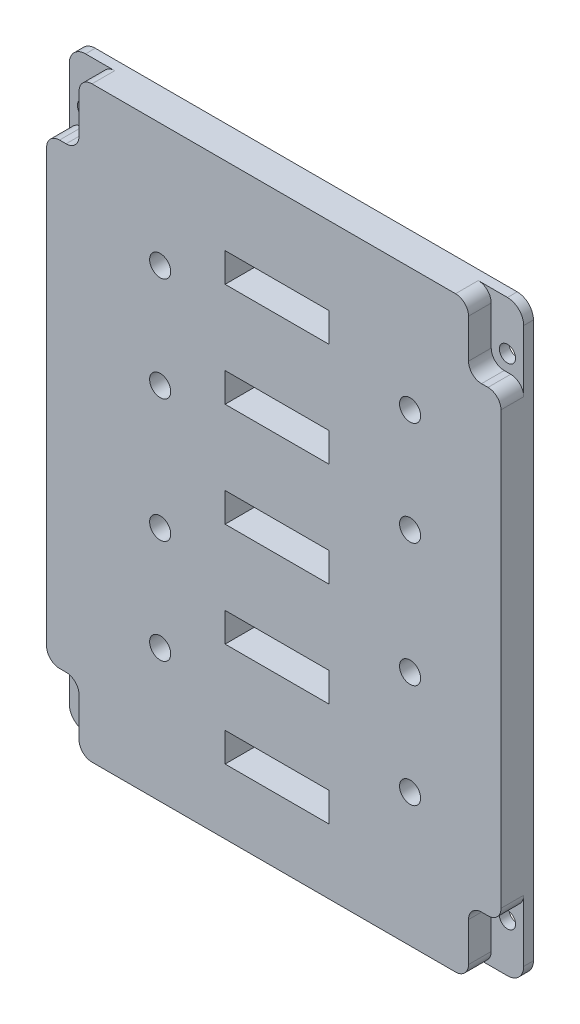
from build123d import *

# Parameters (mm, degrees)
SKETCH1_R           = 3.25
SKETCH1_W           = 32
SKETCH1_H           = 9
BOSS_EXTRUDE1_DEPTH = 10
CUT_EXTRUDE1_DEPTH  = 7
SKETCH3_R           = 2.5
CUT_EXTRUDE2_DEPTH  = 10
FILLET1_R           = 4


with BuildPart() as part:
    # Sketch1 → Boss-Extrude1 (new body)
    with BuildSketch(Plane.XY):
        with BuildLine():
            Line((-67.322274882, 42.630331754), (62.677725118, 42.630331754))
            ThreePointArc((62.677725118, 42.630331754), (66.213259024, 41.165865659), (67.677725118, 37.630331754))
            Line((67.677725118, 37.630331754), (67.677725118, -133.369668246))
            ThreePointArc((67.677725118, -133.369668246), (66.213259024, -136.905202152), (62.677725118, -138.369668246))
            Line((62.677725118, -138.369668246), (-67.322274882, -138.369668246))
            ThreePointArc((-67.322274882, -138.369668246), (-70.857808787, -136.905202152), (-72.322274882, -133.369668246))
            Line((-72.322274882, -133.369668246), (-72.322274882, 37.630331754))
            ThreePointArc((-72.322274882, 37.630331754), (-70.857808787, 41.165865659), (-67.322274882, 42.630331754))
        make_face()
        with Locations((-37.322274882, 4.630331754)):
            Circle(SKETCH1_R, mode=Mode.SUBTRACT)
        with Locations((-37.322274882, -27.369668246)):
            Circle(SKETCH1_R, mode=Mode.SUBTRACT)
        with Locations((-37.322274882, -65.369668246)):
            Circle(SKETCH1_R, mode=Mode.SUBTRACT)
        with Locations((-37.322274882, -97.369668246)):
            Circle(SKETCH1_R, mode=Mode.SUBTRACT)
        with Locations((39.677725118, 4.630331754)):
            Circle(SKETCH1_R, mode=Mode.SUBTRACT)
        with Locations((39.677725118, -27.369668246)):
            Circle(SKETCH1_R, mode=Mode.SUBTRACT)
        with Locations((39.677725118, -65.369668246)):
            Circle(SKETCH1_R, mode=Mode.SUBTRACT)
        with Locations((39.677725118, -97.369668246)):
            Circle(SKETCH1_R, mode=Mode.SUBTRACT)
        with Locations((-1.322274882, 14.130331754)):
            Rectangle(SKETCH1_W, SKETCH1_H, mode=Mode.SUBTRACT)
        with Locations((-1.322274882, -17.869668246)):
            Rectangle(SKETCH1_W, SKETCH1_H, mode=Mode.SUBTRACT)
        with Locations((-1.322274882, -49.869668246)):
            Rectangle(SKETCH1_W, SKETCH1_H, mode=Mode.SUBTRACT)
        with Locations((-1.322274882, -81.869668246)):
            Rectangle(SKETCH1_W, SKETCH1_H, mode=Mode.SUBTRACT)
        with Locations((-1.322274882, -113.869668246)):
            Rectangle(SKETCH1_W, SKETCH1_H, mode=Mode.SUBTRACT)
    extrude(amount=BOSS_EXTRUDE1_DEPTH)

    # Sketch2 → Cut-Extrude1 (cut)
    with BuildSketch(Plane.XY.offset(10)):
        with BuildLine():
            Line((-62.322274882, 42.630331754), (-72.322274882, 42.630331754))
            Line((-72.322274882, 42.630331754), (-72.322274882, 22.630331754))
            Line((-72.322274882, 22.630331754), (-66.322274882, 22.630331754))
            ThreePointArc((-66.322274882, 22.630331754), (-63.493847757, 23.801904629), (-62.322274882, 26.630331754))
            Line((-62.322274882, 26.630331754), (-62.322274882, 42.630331754))
        make_face()
        with BuildLine():
            Line((-72.322274882, -118.369668246), (-66.322274882, -118.369668246))
            ThreePointArc((-66.322274882, -118.369668246), (-63.493847757, -119.541241122), (-62.322274882, -122.369668246))
            Line((-62.322274882, -122.369668246), (-62.322274882, -138.369668246))
            Line((-62.322274882, -138.369668246), (-72.322274882, -138.369668246))
            Line((-72.322274882, -138.369668246), (-72.322274882, -118.369668246))
        make_face()
        with BuildLine():
            Line((57.677725118, -138.369668246), (67.677725118, -138.369668246))
            Line((67.677725118, -138.369668246), (67.677725118, -118.369668246))
            Line((67.677725118, -118.369668246), (61.677725118, -118.369668246))
            ThreePointArc((61.677725118, -118.369668246), (58.849297994, -119.541241122), (57.677725118, -122.369668246))
            Line((57.677725118, -122.369668246), (57.677725118, -138.369668246))
        make_face()
        with BuildLine():
            Line((67.677725118, 22.630331754), (61.677725118, 22.630331754))
            ThreePointArc((61.677725118, 22.630331754), (58.849297994, 23.801904629), (57.677725118, 26.630331754))
            Line((57.677725118, 26.630331754), (57.677725118, 42.630331754))
            Line((57.677725118, 42.630331754), (67.677725118, 42.630331754))
            Line((67.677725118, 42.630331754), (67.677725118, 22.630331754))
        make_face()
    extrude(amount=-CUT_EXTRUDE1_DEPTH, mode=Mode.SUBTRACT)

    # Sketch3 → Cut-Extrude2 (cut)
    with BuildSketch(Plane.XY.offset(3)):
        with Locations((-67.322274882, -123.369668246)):
            Circle(SKETCH3_R)
        with Locations((62.677725118, -123.369668246)):
            Circle(SKETCH3_R)
        with Locations((62.677725118, 27.630331754)):
            Circle(SKETCH3_R)
        with Locations((-67.322274882, 27.630331754)):
            Circle(SKETCH3_R)
    extrude(amount=-CUT_EXTRUDE2_DEPTH, mode=Mode.SUBTRACT)

    # Fillet1
    fillet1_edges = [part.edges().sort_by_distance(p)[0] for p in [
        (57.677725118, 42.630331754, 6.5),
        (67.677725118, 22.630331754, 6.5),
        (67.677725118, -118.369668246, 6.5),
        (57.677725118, -138.369668246, 6.5),
        (-62.322274882, -138.369668246, 6.5),
        (-72.322274882, -118.369668246, 6.5),
        (-72.322274882, 22.630331754, 6.5),
        (-62.322274882, 42.630331754, 6.5),
    ]]
    fillet(fillet1_edges, radius=FILLET1_R)


solid = part.part
